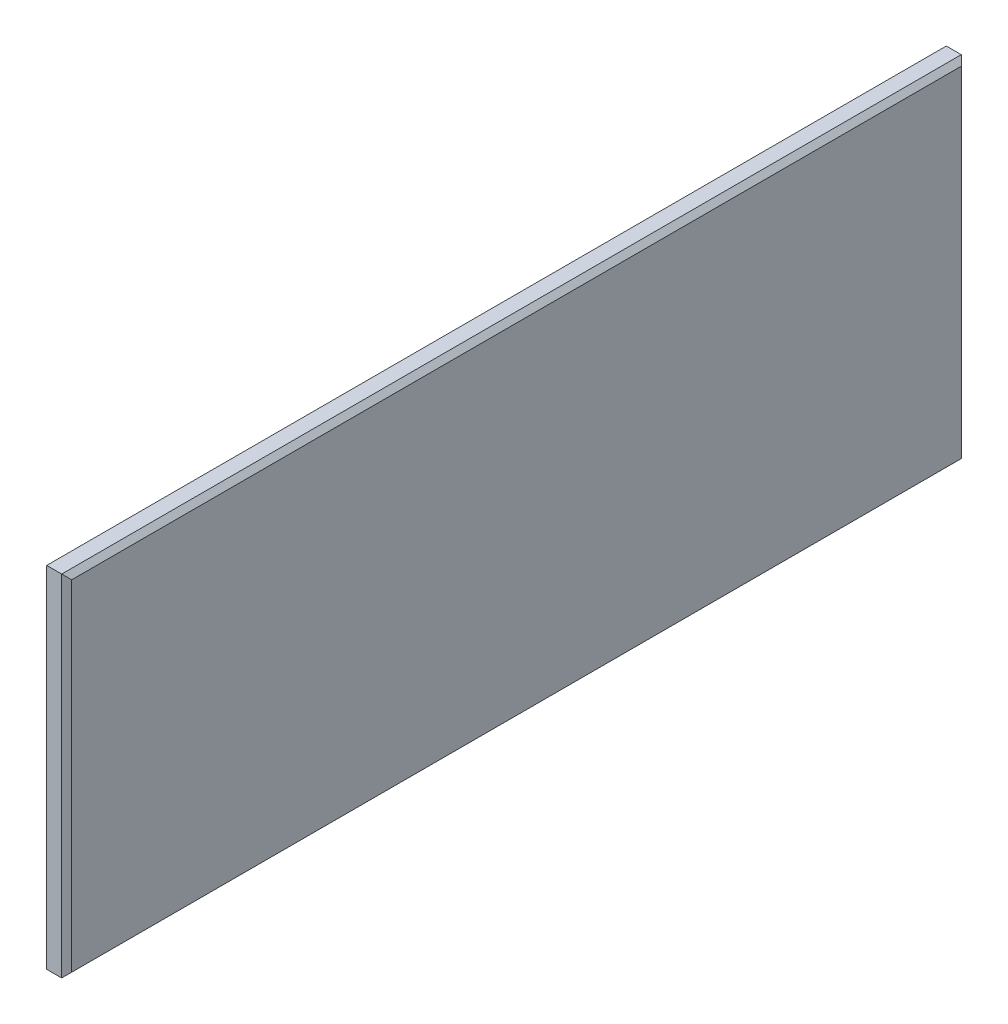
from build123d import *

# Parameters (mm, degrees)
SKETCH1_W           = 5
SKETCH1_H           = 180
BOSS_EXTRUDE1_DEPTH = 70
CHAMFER2_SIZE       = 1


with BuildPart() as part:
    # Sketch1 → Boss-Extrude1 (new body)
    with BuildSketch(Plane(origin=(0, 0, 0), x_dir=(1, 0, 0), z_dir=(0, 1, 0))):
        with Locations((2.5, 90)):
            Rectangle(SKETCH1_W, SKETCH1_H)
    extrude(amount=BOSS_EXTRUDE1_DEPTH)

    # Chamfer2
    chamfer2_edges = [part.edges().sort_by_distance(p)[0] for p in [
        (5, 70, -90),
        (0, 70, -90),
        (5, 0, -90),
        (0, 0, -90),
        (0, 35, -180),
        (5, 35, -180),
        (5, 35, 0),
        (0, 35, 0),
    ]]
    chamfer(chamfer2_edges, length=CHAMFER2_SIZE)


solid = part.part
